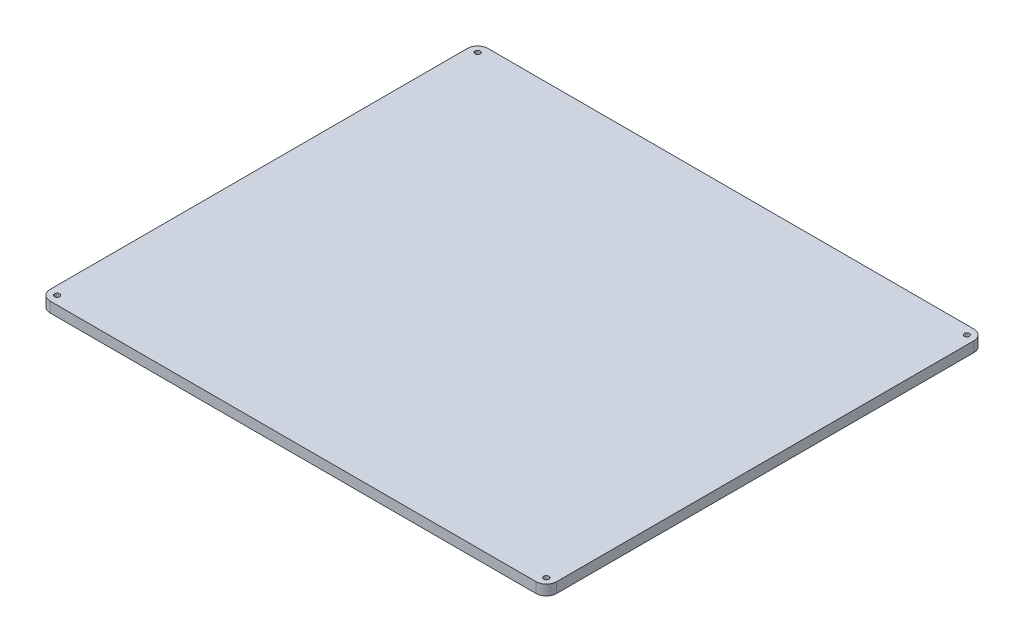
from build123d import *

# Parameters (mm, degrees)
CROQUIS2_R              = 1.5
SALIENTE_EXTRUIR1_DEPTH = 6


with BuildPart() as part:
    # Croquis2 → Saliente-Extruir1 (new body)
    with BuildSketch(Plane(origin=(0, 0, 0), x_dir=(1, 0, 0), z_dir=(0, 1, 0))):
        with BuildLine():
            Line((-121.49563767, 121.75), (161.50436233, 121.75))
            ThreePointArc((161.50436233, 121.75), (165.747003017, 119.992640687), (167.50436233, 115.75))
            Line((167.50436233, 115.75), (167.50436233, -127.25))
            ThreePointArc((167.50436233, -127.25), (165.747003017, -131.492640687), (161.50436233, -133.25))
            Line((161.50436233, -133.25), (-121.49563767, -133.25))
            ThreePointArc((-121.49563767, -133.25), (-125.738278357, -131.492640687), (-127.49563767, -127.25))
            Line((-127.49563767, -127.25), (-127.49563767, 115.75))
            ThreePointArc((-127.49563767, 115.75), (-125.738278357, 119.992640687), (-121.49563767, 121.75))
        make_face()
        with Locations(Location((162.50436233, 116.75, 0), (0, 0, 270))):
            Circle(CROQUIS2_R, mode=Mode.SUBTRACT)
        with Locations(Location((162.50436233, -128.25, 0), (0, 0, 270))):
            Circle(CROQUIS2_R, mode=Mode.SUBTRACT)
        with Locations(Location((-122.49563767, -128.25, 0), (0, 0, 270))):
            Circle(CROQUIS2_R, mode=Mode.SUBTRACT)
        with Locations(Location((-122.49563767, 116.75, 0), (0, 0, 270))):
            Circle(CROQUIS2_R, mode=Mode.SUBTRACT)
    extrude(amount=SALIENTE_EXTRUIR1_DEPTH)


solid = part.part
